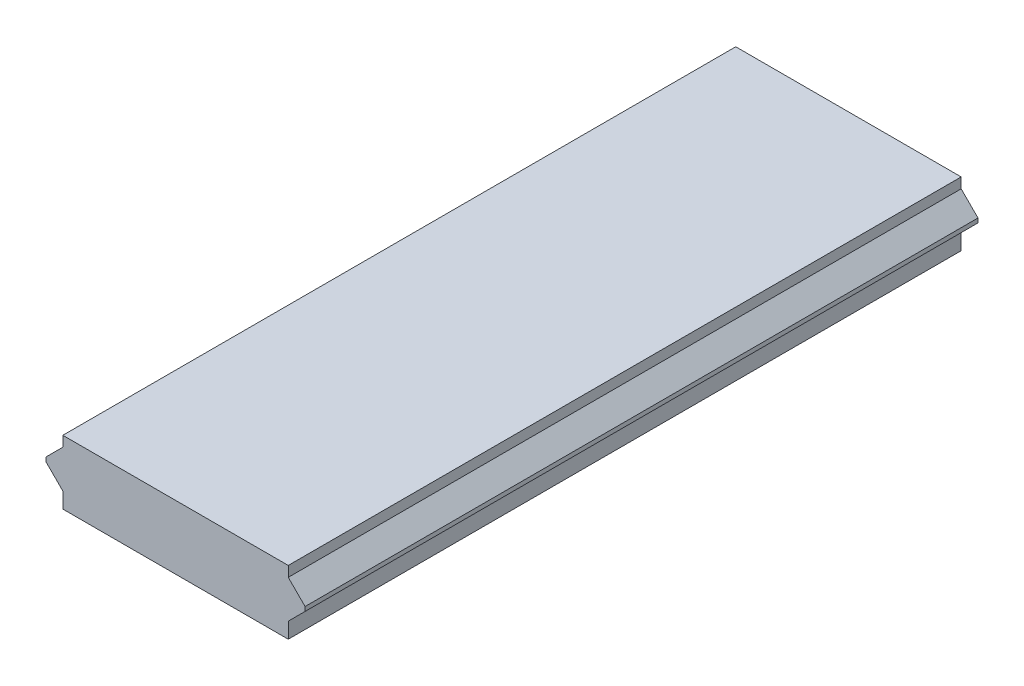
from build123d import *

# Parameters (mm, degrees)
EXTRUDE_1_DEPTH = 200


with BuildPart() as part:
    # 草图1 → 凸台-拉伸1 (new body)
    with BuildSketch(Plane.XY):
        Polygon((-6, 30.779006664), (-73, 30.779006664), (-73, 35.435860913), (-78, 40.435860913), (-78, 41.707938852), (-73, 46.707938852), (-73, 49.779006664), (-6, 49.779006664), (-6, 46.707938852), (-1, 41.707938852), (-1, 40.435860913), (-6, 35.435860913), align=None)
    extrude(amount=-EXTRUDE_1_DEPTH)


solid = part.part
